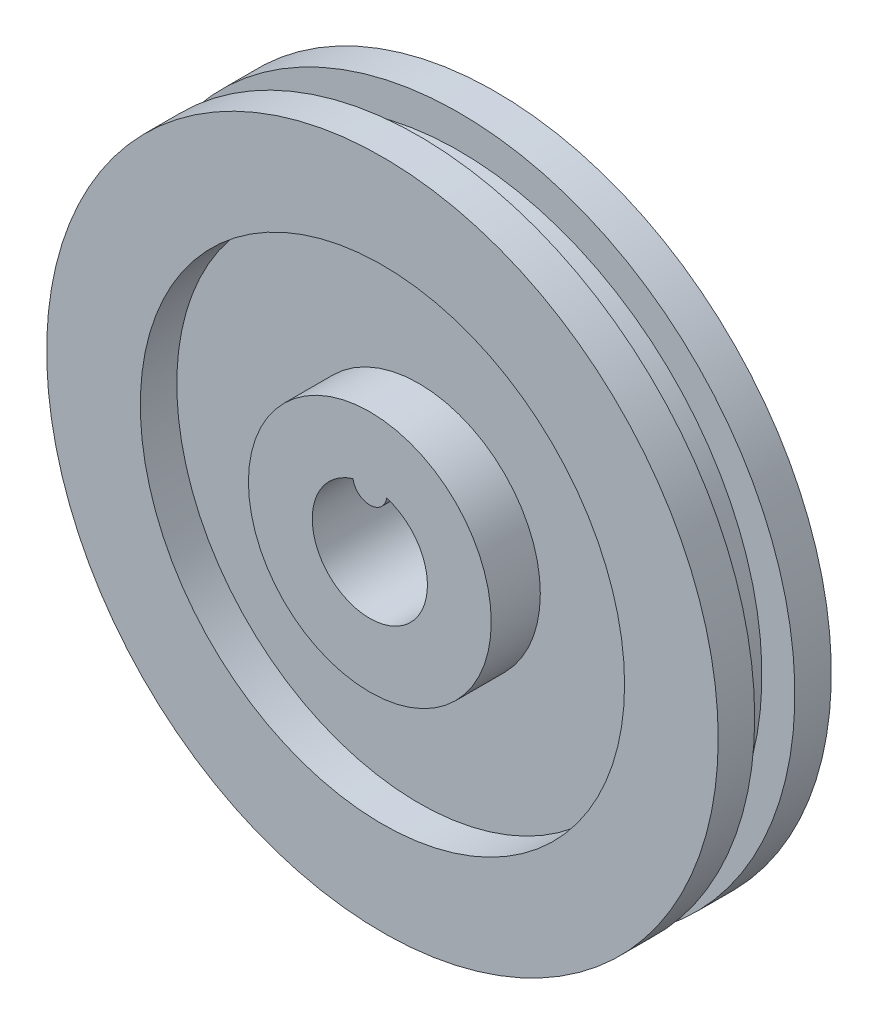
from build123d import *

# Parameters (mm, degrees)
SKETCH1_R           = 8.855
BOSS_EXTRUDE1_DEPTH = 5.045
SKETCH2_R           = 22.085
SKETCH2_R_2         = 8.855
BOSS_EXTRUDE2_DEPTH = 1.465
SKETCH4_R           = 24.49
SKETCH4_R_2         = 17.66
BOSS_EXTRUDE3_DEPTH = 2.66
BOSS_EXTRUDE4_START = 2.66
SKETCH5_R           = 24.49
SKETCH5_R_2         = 17.66
BOSS_EXTRUDE4_DEPTH = 2.66


with BuildPart() as part:
    # Sketch1 → Boss-Extrude1 (new, symmetric)
    with BuildSketch(Plane.XY):
        Circle(SKETCH1_R)
        with BuildLine():
            ThreePointArc((-1.226414925, 4.016952381), (0, -4.2), (1.226414925, 4.016952381))
            ThreePointArc((1.226414925, 4.016952381), (0, 2.96), (-1.226414925, 4.016952381))
        make_face(mode=Mode.SUBTRACT)
    extrude(amount=BOSS_EXTRUDE1_DEPTH, both=True)

    # Sketch2 → Boss-Extrude2 (add, symmetric)
    with BuildSketch(Plane.XY):
        with Locations(Location((0, 0, 0), (0, 0, 180))):
            Circle(SKETCH2_R)
        Circle(SKETCH2_R_2, mode=Mode.SUBTRACT)
    extrude(amount=BOSS_EXTRUDE2_DEPTH, both=True)

    # Sketch4 → Boss-Extrude3 (add)
    with BuildSketch(Plane.XY.offset(1.465)):
        Circle(SKETCH4_R)
        Circle(SKETCH4_R_2, mode=Mode.SUBTRACT)
    extrude(amount=BOSS_EXTRUDE3_DEPTH)

    # Sketch5 → Boss-Extrude4 (add)
    with BuildSketch(Plane(origin=(0, 0, -1.465), x_dir=(-1, 0, 0), z_dir=(0, 0, -1)).offset(BOSS_EXTRUDE4_START)):
        with Locations(Location((0, 0, 0), (0, 0, 180))):
            Circle(SKETCH5_R)
        with Locations(Location((0, 0, 0), (0, 0, 180))):
            Circle(SKETCH5_R_2, mode=Mode.SUBTRACT)
    extrude(amount=-BOSS_EXTRUDE4_DEPTH)


solid = part.part
